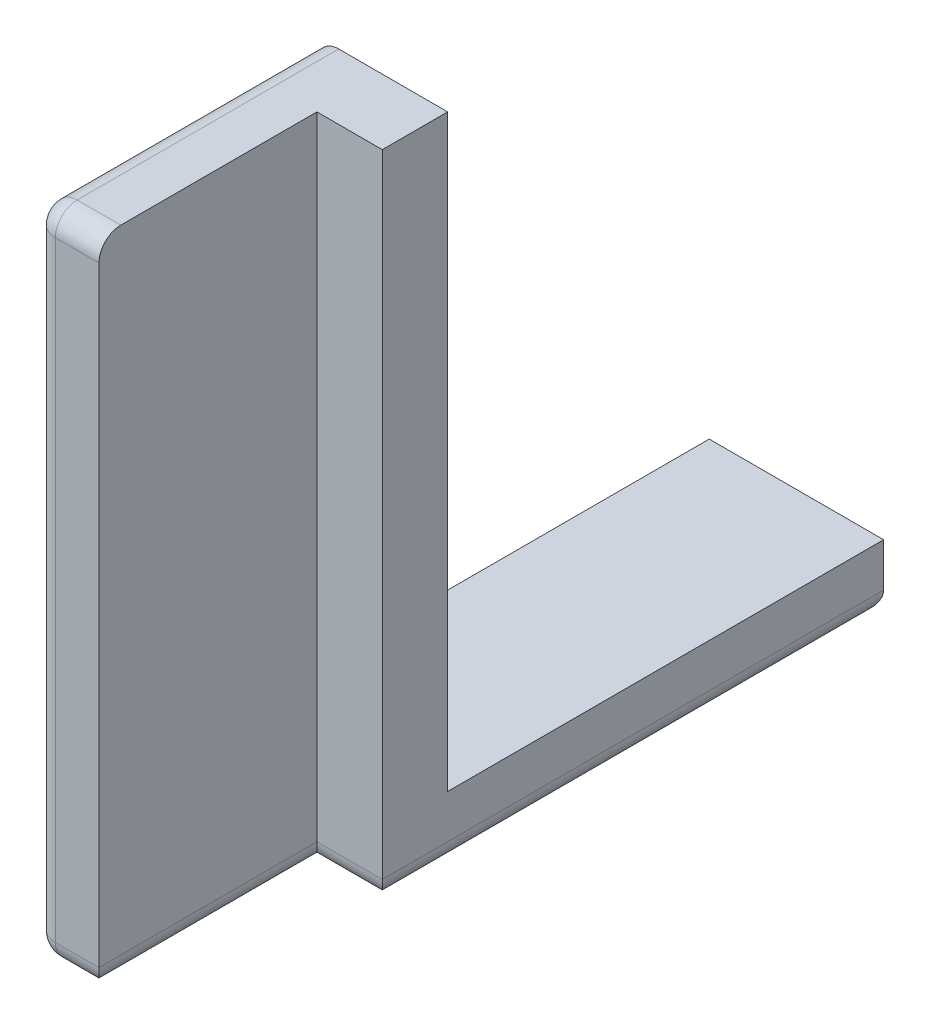
from build123d import *

# Parameters (mm, degrees)
SKETCH1_W            = 3
SKETCH1_H            = 30
BOSS_EXTRUDE1_DEPTH  = 3
SKETCH8_W            = 3
SKETCH8_H            = 3
BOSS_EXTRUDE7_DEPTH  = 20
SKETCH9_W            = 20
SKETCH9_H            = 3
BOSS_EXTRUDE8_DEPTH  = 5
SKETCH12_W           = 3
SKETCH12_H           = 30
BOSS_EXTRUDE10_DEPTH = 3
SKETCH13_W           = 3
SKETCH13_H           = 30
BOSS_EXTRUDE11_DEPTH = 10
FILLET6_R            = 1


with BuildPart() as part:
    # Sketch1 → Boss-Extrude1 (new body)
    with BuildSketch(Plane.XY):
        with Locations((1.5, -15)):
            Rectangle(SKETCH1_W, SKETCH1_H)
    extrude(amount=BOSS_EXTRUDE1_DEPTH)

    # Sketch8 → Boss-Extrude7 (add)
    with BuildSketch(Plane(origin=(0, 0, 0), x_dir=(-1, 0, 0), z_dir=(0, 0, -1))):
        with Locations((-1.5, -28.5)):
            Rectangle(SKETCH8_W, SKETCH8_H)
    extrude(amount=BOSS_EXTRUDE7_DEPTH)

    # Sketch9 → Boss-Extrude8 (add)
    with BuildSketch(Plane.ZY):
        with Locations((-10, -28.5)):
            Rectangle(SKETCH9_W, SKETCH9_H)
    extrude(amount=BOSS_EXTRUDE8_DEPTH)

    # Sketch12 → Boss-Extrude10 (add)
    with BuildSketch(Plane.ZY):
        with Locations((1.5, -15)):
            Rectangle(SKETCH12_W, SKETCH12_H)
    extrude(amount=BOSS_EXTRUDE10_DEPTH)

    # Sketch13 → Boss-Extrude11 (add)
    with BuildSketch(Plane.XY.offset(3)):
        with Locations((-1.5, -15)):
            Rectangle(SKETCH13_W, SKETCH13_H)
    extrude(amount=BOSS_EXTRUDE11_DEPTH)

    # Fillet6
    fillet6_edges = [part.edges().sort_by_distance(p)[0] for p in [
        (-1, -30, -20),
        (-4, -30, 0),
        (-5, -30, -10),
        (-5, -28.5, 0),
        (-3, 0, 6.5),
        (-3, -30, 6.5),
        (1.5, -30, 3),
        (0, -30, 8),
        (-1.5, 0, 13),
        (-3, -15, 13),
        (-1.5, -30, 13),
        (3, -30, -8.5),
    ]]
    fillet(fillet6_edges, radius=FILLET6_R)


solid = part.part
